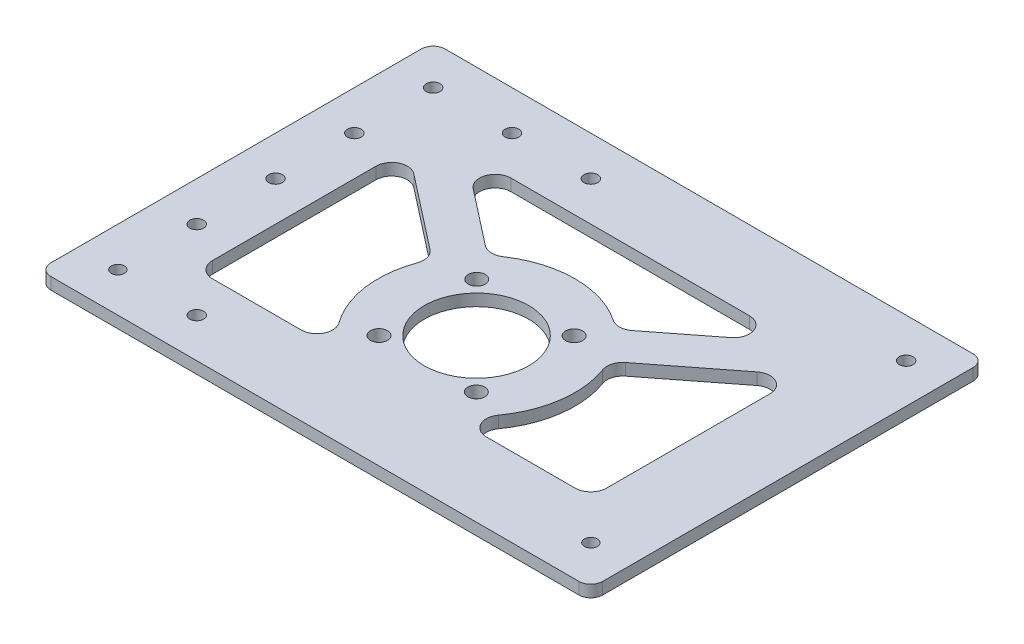
from build123d import *

# Parameters (mm, degrees)
SKETCH_1_W          = 140
SKETCH_1_H          = 100
EXTRUDE_1_DEPTH     = 3
SKETCH_2_R          = 13.25
SKETCH_2_R_2        = 2.15
CUT_EXTRUDE_1_DEPTH = 3
CUT_EXTRUDE_2_REACH = 88.076
SKETCH_4_R          = 1.75
SKETCH_4_R_2        = 1.65
EXTRUDE_2_DEPTH     = 3
FILLET_1_R          = 4
FILLET_2_R          = 3
CUT_EXTRUDE_3_REACH = 88.076
SKETCH_6_R          = 1.75


with BuildPart() as part:
    # 草图1 → 凸台-拉伸1 (new body)
    with BuildSketch(Plane(origin=(0, 0, 0), x_dir=(1, 0, 0), z_dir=(0, 1, 0))):
        Rectangle(SKETCH_1_W, SKETCH_1_H)
    extrude(amount=EXTRUDE_1_DEPTH)

    # 草图2 → 切除-拉伸1 (cut)
    with BuildSketch(Plane(origin=(0, 3, 0), x_dir=(1, 0, 0), z_dir=(0, 1, 0))):
        with Locations((0, -9)):
            Circle(SKETCH_2_R)
        with Locations((-12.347550503, 3.401128843)):
            Circle(SKETCH_2_R_2)
        with Locations((12.401128843, 3.347550503)):
            Circle(SKETCH_2_R_2)
        with Locations((12.347550503, -21.401128843)):
            Circle(SKETCH_2_R_2)
        with Locations((-12.401128843, -21.347550503)):
            Circle(SKETCH_2_R_2)
    extrude(amount=-CUT_EXTRUDE_1_DEPTH, mode=Mode.SUBTRACT)

    # 草图4 → 切除-拉伸2 (cut, up to next)
    with BuildSketch(Plane(origin=(0, 3, 0), x_dir=(1, 0, 0), z_dir=(0, 1, 0)), mode=Mode.PRIVATE) as cut_extrude_2_sk1:
        with Locations((-60, 40)):
            Circle(SKETCH_4_R)
    cut_extrude_2_tool1 = extrude(cut_extrude_2_sk1.sketch, amount=-CUT_EXTRUDE_2_REACH, mode=Mode.PRIVATE) & part.part
    # 草图4 → 切除-拉伸2 (cut, up to next)
    with BuildSketch(Plane(origin=(0, 3, 0), x_dir=(1, 0, 0), z_dir=(0, 1, 0)), mode=Mode.PRIVATE) as cut_extrude_2_sk2:
        with Locations((-60, -40)):
            Circle(SKETCH_4_R_2)
    cut_extrude_2_tool2 = extrude(cut_extrude_2_sk2.sketch, amount=-CUT_EXTRUDE_2_REACH, mode=Mode.PRIVATE) & part.part
    # 草图4 → 切除-拉伸2 (cut, up to next)
    with BuildSketch(Plane(origin=(0, 3, 0), x_dir=(1, 0, 0), z_dir=(0, 1, 0)), mode=Mode.PRIVATE) as cut_extrude_2_sk3:
        with Locations((60, -40)):
            Circle(SKETCH_4_R_2)
    cut_extrude_2_tool3 = extrude(cut_extrude_2_sk3.sketch, amount=-CUT_EXTRUDE_2_REACH, mode=Mode.PRIVATE) & part.part
    # 草图4 → 切除-拉伸2 (cut, up to next)
    with BuildSketch(Plane(origin=(0, 3, 0), x_dir=(1, 0, 0), z_dir=(0, 1, 0)), mode=Mode.PRIVATE) as cut_extrude_2_sk4:
        with Locations((60, 40)):
            Circle(SKETCH_4_R)
    cut_extrude_2_tool4 = extrude(cut_extrude_2_sk4.sketch, amount=-CUT_EXTRUDE_2_REACH, mode=Mode.PRIVATE) & part.part
    # 草图4 → 切除-拉伸2 (cut, up to next)
    with BuildSketch(Plane(origin=(0, 3, 0), x_dir=(1, 0, 0), z_dir=(0, 1, 0)), mode=Mode.PRIVATE) as cut_extrude_2_sk5:
        with BuildLine():
            Line((13.564659966, -30), (50, -30))
            Line((50, -30), (50, 30))
            Line((50, 30), (-50, 30))
            Line((-50, 30), (-50, -30))
            Line((-50, -30), (-13.564659966, -30))
            ThreePointArc((-13.564659966, -30), (0, 16), (13.564659966, -30))
        make_face()
    cut_extrude_2_tool5 = extrude(cut_extrude_2_sk5.sketch, amount=-CUT_EXTRUDE_2_REACH, mode=Mode.PRIVATE) & part.part
    add(cut_extrude_2_tool1.solids().sort_by_distance((-60, 3, -40))[0], mode=Mode.SUBTRACT)
    add(cut_extrude_2_tool2.solids().sort_by_distance((-60, 3, 40))[0], mode=Mode.SUBTRACT)
    add(cut_extrude_2_tool3.solids().sort_by_distance((60, 3, 40))[0], mode=Mode.SUBTRACT)
    add(cut_extrude_2_tool4.solids().sort_by_distance((60, 3, -40))[0], mode=Mode.SUBTRACT)
    add(cut_extrude_2_tool5.solids().sort_by_distance((31.78233, 3, 28.83381))[0], mode=Mode.SUBTRACT)

    # 草图5 → 凸台-拉伸2 (add)
    with BuildSketch(Plane(origin=(0, 3, 0), x_dir=(1, 0, 0), z_dir=(0, 1, 0))):
        Polygon((46.998056898, 33.999619926), (12.318341703, 6.949442073), (18.46865969, -0.935580987), (53.001943102, 26.000380074), align=None)
        Polygon((-18.46865969, -0.935580987), (-53.001943102, 26.000380074), (-46.998056898, 33.999619926), (-12.318341703, 6.949442073), align=None)
    extrude(amount=-EXTRUDE_2_DEPTH)

    # 圆角1
    fillet_1_edges = [part.edges().sort_by_distance(p)[0] for p in [
        (16.239124114, 1.5, -10.007652354),
        (-16.239124114, 1.5, -10.007652354),
        (13.564659966, 1.5, 30),
        (-13.564659966, 1.5, 30),
        (22.389442101, 1.5, -2.122629294),
        (-22.389442101, 1.5, -2.122629294),
        (50, 1.5, 30),
        (-50, 1.5, 30),
        (50, 1.5, -23.658864455),
        (41.870339045, 1.5, -30),
        (-41.870339045, 1.5, -30),
        (-50, 1.5, -23.658864455),
    ]]
    fillet(fillet_1_edges, radius=FILLET_1_R)

    # 圆角2
    fillet_2_edges = [part.edges().sort_by_distance(p)[0] for p in [
        (70, 1.5, 50),
        (70, 1.5, -50),
        (-70, 1.5, 50),
        (-70, 1.5, -50),
    ]]
    fillet(fillet_2_edges, radius=FILLET_2_R)

    # 草图6 → 切除-拉伸3 (cut, up to next)
    with BuildSketch(Plane(origin=(0, 3, 0), x_dir=(1, 0, 0), z_dir=(0, 1, 0)), mode=Mode.PRIVATE) as cut_extrude_3_sk1:
        with Locations((-40, 40)):
            Circle(SKETCH_6_R)
    cut_extrude_3_tool1 = extrude(cut_extrude_3_sk1.sketch, amount=-CUT_EXTRUDE_3_REACH, mode=Mode.PRIVATE) & part.part
    # 草图6 → 切除-拉伸3 (cut, up to next)
    with BuildSketch(Plane(origin=(0, 3, 0), x_dir=(1, 0, 0), z_dir=(0, 1, 0)), mode=Mode.PRIVATE) as cut_extrude_3_sk2:
        with Locations((-20, 40)):
            Circle(SKETCH_6_R)
    cut_extrude_3_tool2 = extrude(cut_extrude_3_sk2.sketch, amount=-CUT_EXTRUDE_3_REACH, mode=Mode.PRIVATE) & part.part
    # 草图6 → 切除-拉伸3 (cut, up to next)
    with BuildSketch(Plane(origin=(0, 3, 0), x_dir=(1, 0, 0), z_dir=(0, 1, 0)), mode=Mode.PRIVATE) as cut_extrude_3_sk3:
        with Locations((-60, 20)):
            Circle(SKETCH_6_R)
    cut_extrude_3_tool3 = extrude(cut_extrude_3_sk3.sketch, amount=-CUT_EXTRUDE_3_REACH, mode=Mode.PRIVATE) & part.part
    # 草图6 → 切除-拉伸3 (cut, up to next)
    with BuildSketch(Plane(origin=(0, 3, 0), x_dir=(1, 0, 0), z_dir=(0, 1, 0)), mode=Mode.PRIVATE) as cut_extrude_3_sk4:
        with Locations((-60, -20)):
            Circle(SKETCH_6_R)
    cut_extrude_3_tool4 = extrude(cut_extrude_3_sk4.sketch, amount=-CUT_EXTRUDE_3_REACH, mode=Mode.PRIVATE) & part.part
    # 草图6 → 切除-拉伸3 (cut, up to next)
    with BuildSketch(Plane(origin=(0, 3, 0), x_dir=(1, 0, 0), z_dir=(0, 1, 0)), mode=Mode.PRIVATE) as cut_extrude_3_sk5:
        with Locations((-60, 0)):
            Circle(SKETCH_6_R)
    cut_extrude_3_tool5 = extrude(cut_extrude_3_sk5.sketch, amount=-CUT_EXTRUDE_3_REACH, mode=Mode.PRIVATE) & part.part
    # 草图6 → 切除-拉伸3 (cut, up to next)
    with BuildSketch(Plane(origin=(0, 3, 0), x_dir=(1, 0, 0), z_dir=(0, 1, 0)), mode=Mode.PRIVATE) as cut_extrude_3_sk6:
        with Locations((-40, -40)):
            Circle(SKETCH_6_R)
    cut_extrude_3_tool6 = extrude(cut_extrude_3_sk6.sketch, amount=-CUT_EXTRUDE_3_REACH, mode=Mode.PRIVATE) & part.part
    add(cut_extrude_3_tool1.solids().sort_by_distance((-40, 3, -40))[0], mode=Mode.SUBTRACT)
    add(cut_extrude_3_tool2.solids().sort_by_distance((-20, 3, -40))[0], mode=Mode.SUBTRACT)
    add(cut_extrude_3_tool3.solids().sort_by_distance((-60, 3, -20))[0], mode=Mode.SUBTRACT)
    add(cut_extrude_3_tool4.solids().sort_by_distance((-60, 3, 20))[0], mode=Mode.SUBTRACT)
    add(cut_extrude_3_tool5.solids().sort_by_distance((-60, 3, 0))[0], mode=Mode.SUBTRACT)
    add(cut_extrude_3_tool6.solids().sort_by_distance((-40, 3, 40))[0], mode=Mode.SUBTRACT)


solid = part.part
